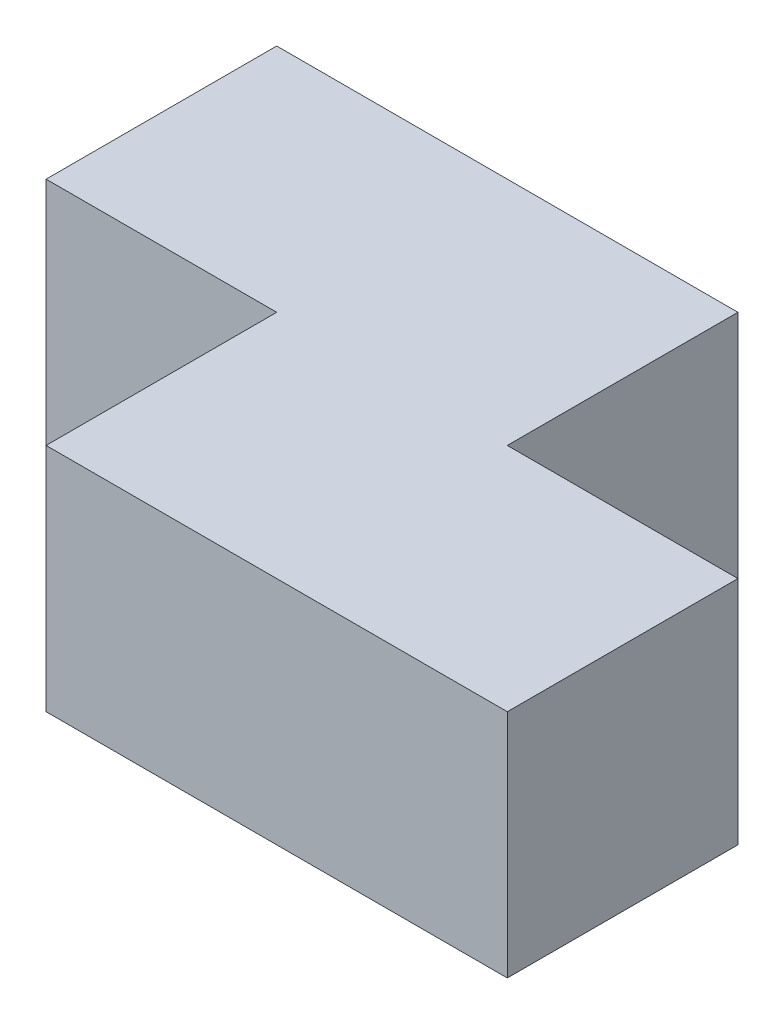
from build123d import *

# Parameters (mm, degrees)
SKETCH_1_W      = 60
SKETCH_1_H      = 30
SKETCH_1_W_2    = 30
EXTRUDE_1_DEPTH = 30
SKETCH_4_W      = 30
SKETCH_4_H      = 30
EXTRUDE_4_DEPTH = 60


with BuildPart() as part:
    # 草圖1 → 填料-伸長1 (new body)
    with BuildSketch(Plane(origin=(0, 0, 0), x_dir=(1, 0, 0), z_dir=(0, 1, 0))):
        with Locations((30, 15)):
            Rectangle(SKETCH_1_W, SKETCH_1_H)
        with Locations((15, 45)):
            Rectangle(SKETCH_1_W_2, SKETCH_1_H)
    extrude(amount=EXTRUDE_1_DEPTH)

    # 草圖4 → 填料-伸長4 (add)
    with BuildSketch(Plane(origin=(30, 0, 0), x_dir=(0, 0, -1), z_dir=(1, 0, 0))):
        with Locations((45, 15)):
            Rectangle(SKETCH_4_W, SKETCH_4_H)
    extrude(amount=-EXTRUDE_4_DEPTH)


solid = part.part
